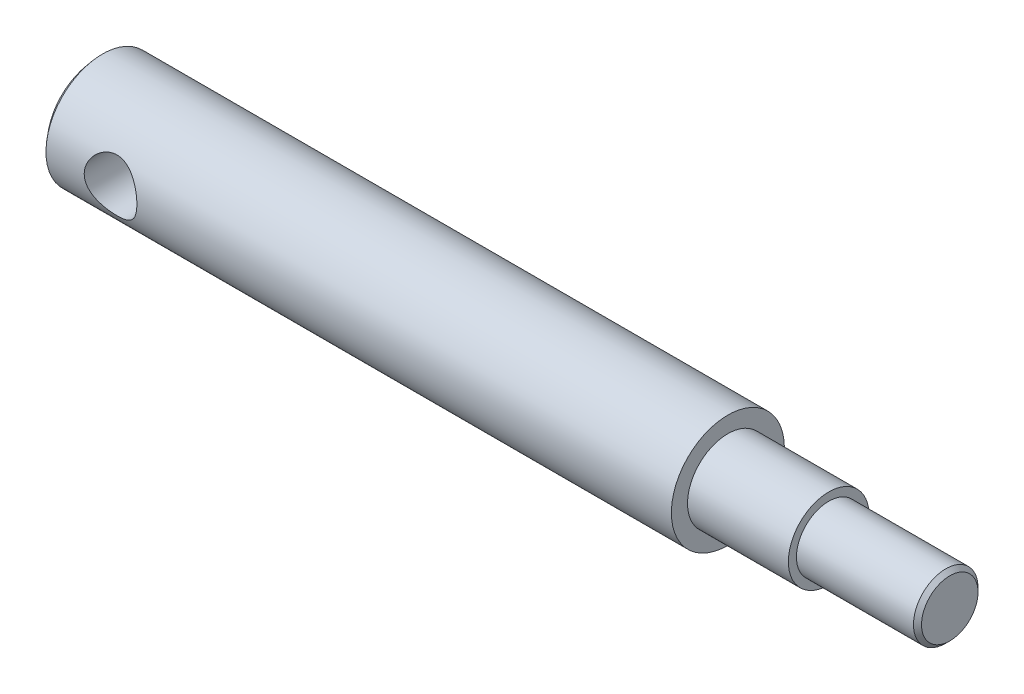
from build123d import *

# Parameters (mm, degrees)
SKETCH3_R          = 6.525
CUT_EXTRUDE4_DEPTH = 54.5


with BuildPart() as part:
    # Sketch1 → Revolve2 (revolve)
    with BuildSketch(Plane.XY, mode=Mode.PRIVATE) as revolve2_sk:
        with BuildLine():
            Line((0, 0), (216, 0))
            Line((216, 0), (216, 7))
            Line((216, 7), (215, 8))
            Line((215, 8), (186, 8))
            Line((186, 8), (186, 10))
            Line((186, 10), (161, 10))
            Line((161, 10), (161, 14))
            Line((161, 14), (6, 14))
            ThreePointArc((6, 14), (1.749749003, 7.535821856), (0, 0))
        make_face()
    revolve(revolve2_sk.sketch.rotate(Axis((0, 0, 0), (1, 0, 0)), 180), axis=Axis((0, 0, 0), (1, 0, 0)))

    # Sketch3 → Cut-Extrude4 (cut, symmetric)
    with BuildSketch(Plane.XY):
        with Locations((22, 0)):
            Circle(SKETCH3_R)
    extrude(amount=CUT_EXTRUDE4_DEPTH, both=True, mode=Mode.SUBTRACT)


solid = part.part
